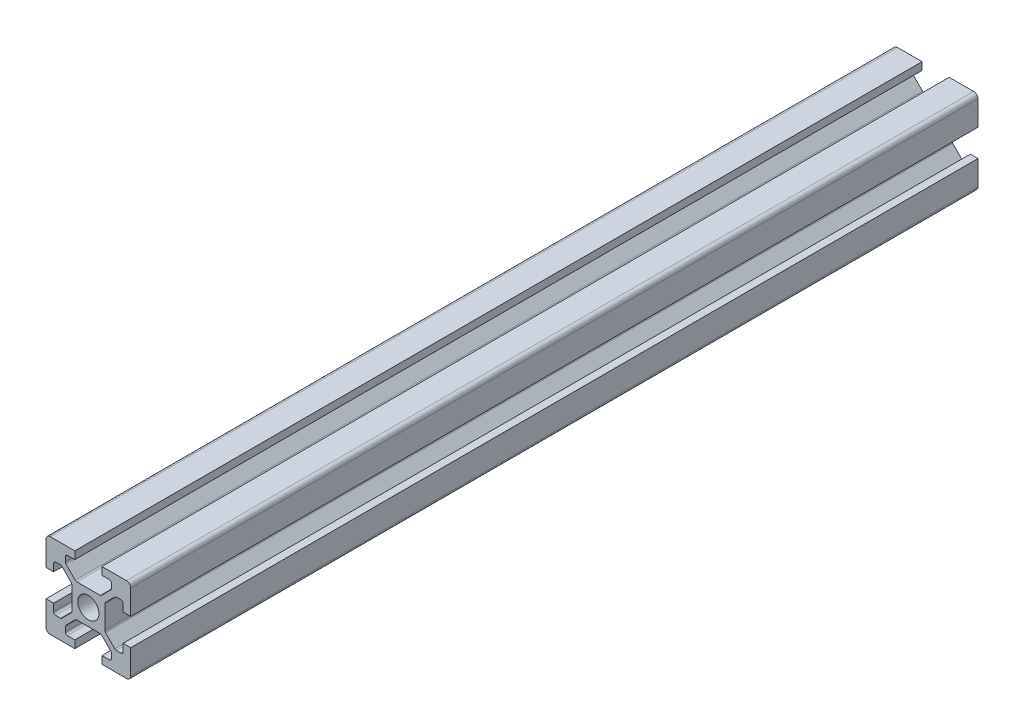
from build123d import *

# Parameters (mm, degrees)
SKETCH1_R           = 2.5
BOSS_EXTRUDE1_DEPTH = 200
FILLET1_R           = 1
FILLET2_R           = 0.5
FILLET3_R           = 0.5
FILLET4_R           = 0.5
FILLET5_R           = 0.5


with BuildPart() as part:
    # Sketch1 → Boss-Extrude1 (new body)
    with BuildSketch(Plane.XY):
        Polygon((13.2, 0), (13.2, 1.8), (15.45, 1.8), (15.45, 3.6), (12.95, 6.1), (7.05, 6.1), (4.55, 3.6), (4.55, 1.8), (6.8, 1.8), (6.8, 0), (0, 0), (0, 6.8), (1.8, 6.8), (1.8, 4.55), (3.6, 4.55), (6.1, 7.05), (6.1, 12.95), (3.6, 15.45), (1.8, 15.45), (1.8, 13.2), (0, 13.2), (0, 20), (6.8, 20), (6.8, 18.2), (4.55, 18.2), (4.55, 16.4), (7.05, 13.9), (12.95, 13.9), (15.45, 16.4), (15.45, 18.2), (13.2, 18.2), (13.2, 20), (20, 20), (20, 13.2), (18.2, 13.2), (18.2, 15.45), (16.4, 15.45), (13.9, 12.95), (13.9, 7.05), (16.4, 4.55), (18.2, 4.55), (18.2, 6.8), (20, 6.8), (20, 0), align=None)
        with Locations((10, 10)):
            Circle(SKETCH1_R, mode=Mode.SUBTRACT)
    extrude(amount=BOSS_EXTRUDE1_DEPTH)

    # Fillet1
    fillet1_edges = [part.edges().sort_by_distance(p)[0] for p in [
        (0, 0, 100),
        (0, 20, 100),
        (20, 20, 100),
        (20, 0, 100),
    ]]
    fillet(fillet1_edges, radius=FILLET1_R)

    # Fillet2
    fillet2_edges = [part.edges().sort_by_distance(p)[0] for p in [
        (4.55, 18.2, 100),
        (4.55, 16.4, 100),
        (7.05, 13.9, 100),
        (12.95, 13.9, 100),
        (15.45, 16.4, 100),
        (15.45, 18.2, 100),
    ]]
    fillet(fillet2_edges, radius=FILLET2_R)

    # Fillet3
    fillet3_edges = [part.edges().sort_by_distance(p)[0] for p in [
        (18.2, 15.45, 100),
        (16.4, 15.45, 100),
        (13.9, 12.95, 100),
        (13.9, 7.05, 100),
        (16.4, 4.55, 100),
        (18.2, 4.55, 100),
    ]]
    fillet(fillet3_edges, radius=FILLET3_R)

    # Fillet4
    fillet4_edges = [part.edges().sort_by_distance(p)[0] for p in [
        (1.8, 4.55, 100),
        (3.6, 4.55, 100),
        (6.1, 7.05, 100),
        (6.1, 12.95, 100),
        (3.6, 15.45, 100),
        (1.8, 15.45, 100),
    ]]
    fillet(fillet4_edges, radius=FILLET4_R)

    # Fillet5
    fillet5_edges = [part.edges().sort_by_distance(p)[0] for p in [
        (15.45, 1.8, 100),
        (15.45, 3.6, 100),
        (12.95, 6.1, 100),
        (7.05, 6.1, 100),
        (4.55, 3.6, 100),
        (4.55, 1.8, 100),
    ]]
    fillet(fillet5_edges, radius=FILLET5_R)


solid = part.part
